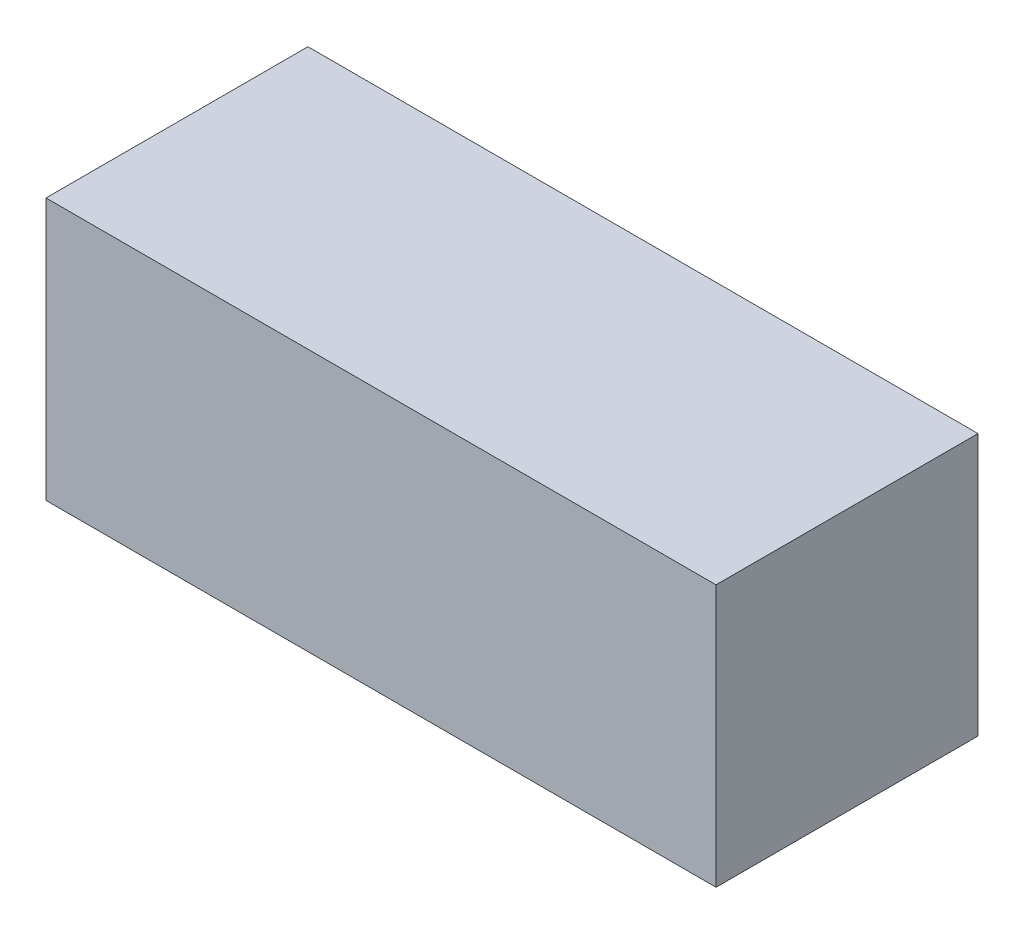
from build123d import *

# Parameters (mm, degrees)
CROQUIS1_W              = 76.735599991
CROQUIS1_H              = 30
SALIENTE_EXTRUIR1_DEPTH = 30


with BuildPart() as part:
    # Croquis1 → Saliente-Extruir1 (new body)
    with BuildSketch(Plane.XY):
        with Locations((-44.897056541, -19.174622183)):
            Rectangle(CROQUIS1_W, CROQUIS1_H)
    extrude(amount=SALIENTE_EXTRUIR1_DEPTH)


solid = part.part
